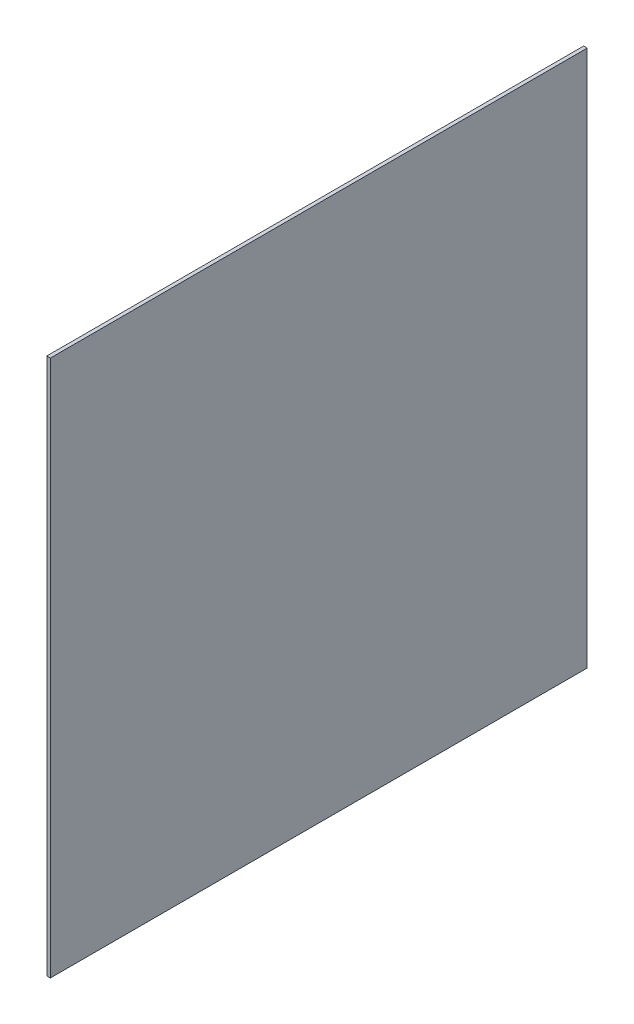
from build123d import *

# Parameters (mm, degrees)
BOSS_EXTRU_2_DEPTH = 10


with BuildPart() as part:
    # Esquisse3D1 → Boss.-Extru.2 (new body)
    with BuildSketch(Plane(origin=(-20, 1121.289346724, 777.274991403), x_dir=(0, -0.7071067811865476, -0.7071067811865476), z_dir=(1, 0, 0))):
        Polygon((0, 0), (1060.66017178, 1060.66017178), (2121.32034356, 0), (1060.66017178, -1060.66017178), align=None)
    extrude(amount=BOSS_EXTRU_2_DEPTH)


solid = part.part
